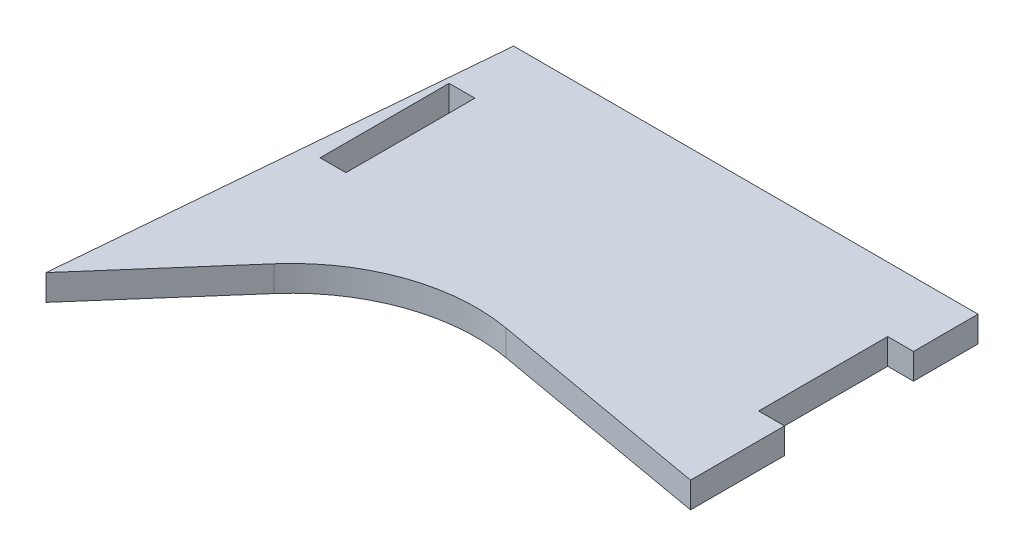
from build123d import *

# Parameters (mm, degrees)
SKETCH1_W           = 3
SKETCH1_H           = 15
BOSS_EXTRUDE1_DEPTH = 3


with BuildPart() as part:
    # Sketch1 → Boss-Extrude1 (new body)
    with BuildSketch(Plane(origin=(0, 0, 0), x_dir=(1, 0, 0), z_dir=(0, 1, 0))):
        with BuildLine():
            Line((0, 0), (-54, 0))
            Line((-54, 0), (-58.374433176, -50))
            Line((-58.374433176, -50), (-46, -35.847809072))
            ThreePointArc((-46, -35.847809072), (-36.962151982, -29.722839373), (-26.081216116, -28.82663331))
            Line((-26.081216116, -28.82663331), (0, -33.425455401))
            Line((0, -33.425455401), (0, -22.5))
            Line((0, -22.5), (-3, -22.5))
            Line((-3, -22.5), (-3, -7.5))
            Line((-3, -7.5), (0, -7.5))
            Line((0, -7.5), (0, 0))
        make_face()
        with Locations((-52.5, -15)):
            Rectangle(SKETCH1_W, SKETCH1_H, mode=Mode.SUBTRACT)
    extrude(amount=BOSS_EXTRUDE1_DEPTH)


solid = part.part
